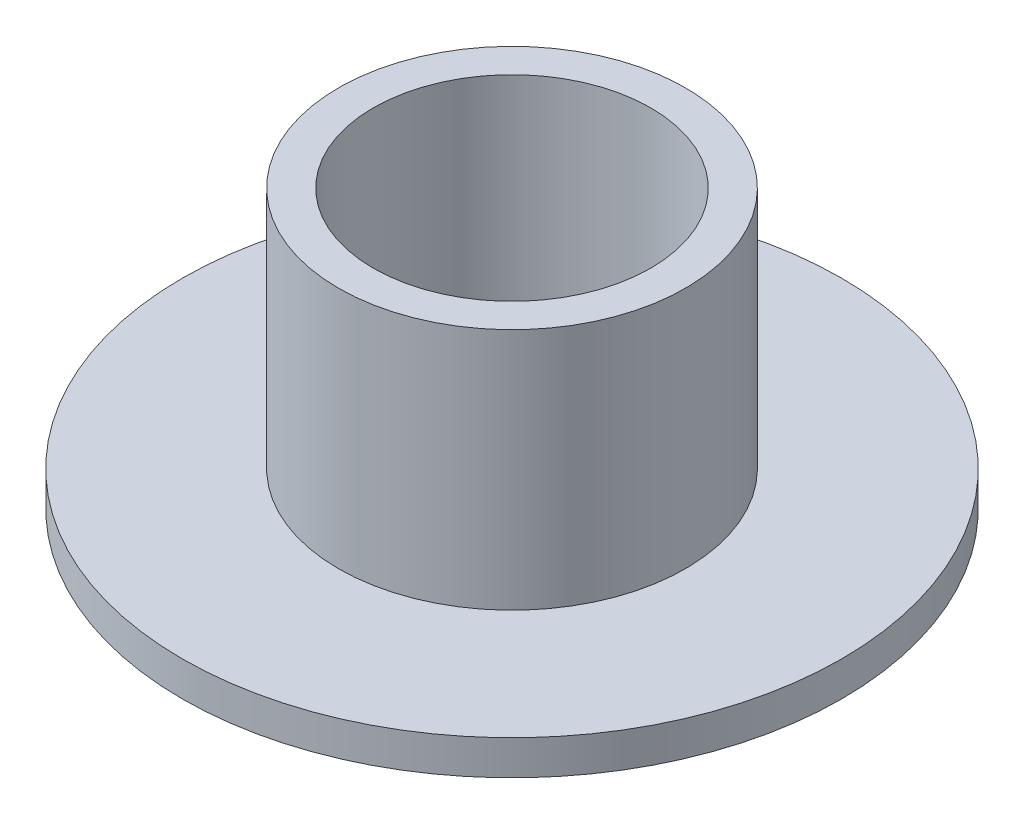
from build123d import *

# Parameters (mm, degrees)
SKETCH_1_R          = 4.75
EXTRUDE_1_DEPTH     = 0.5
SKETCH_2_R          = 2.5
EXTRUDE_2_DEPTH     = 3.5
SKETCH_3_R          = 2
CUT_EXTRUDE_1_DEPTH = 8.818247886


with BuildPart() as part:
    # 草图1 → 凸台-拉伸1 (new body)
    with BuildSketch(Plane(origin=(0, 0, 0), x_dir=(1, 0, 0), z_dir=(0, 1, 0))):
        Circle(SKETCH_1_R)
    extrude(amount=EXTRUDE_1_DEPTH)

    # 草图2 → 凸台-拉伸2 (add)
    with BuildSketch(Plane(origin=(0, 0.5, 0), x_dir=(1, 0, 0), z_dir=(0, 1, 0))):
        Circle(SKETCH_2_R)
    extrude(amount=EXTRUDE_2_DEPTH)

    # 草图3 → 切除-拉伸1 (cut, through all)
    with BuildSketch(Plane.XZ):
        Circle(SKETCH_3_R)
    extrude(amount=-CUT_EXTRUDE_1_DEPTH, mode=Mode.SUBTRACT)


solid = part.part
